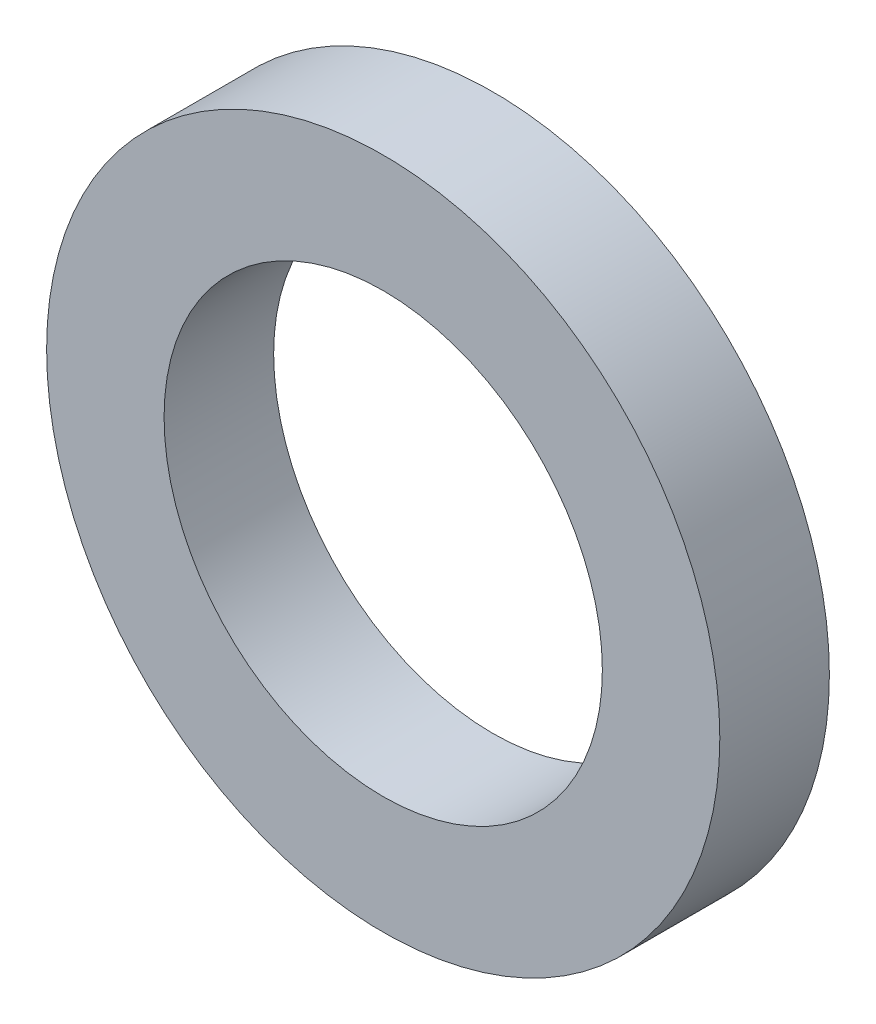
from build123d import *

# Parameters (mm, degrees)
SKETCH1_R           = 9.7536
SKETCH1_R_2         = 6.35
BOSS_EXTRUDE1_DEPTH = 3.175


with BuildPart() as part:
    # Sketch1 → Boss-Extrude1 (new body)
    with BuildSketch(Plane.XY):
        Circle(SKETCH1_R)
        Circle(SKETCH1_R_2, mode=Mode.SUBTRACT)
    extrude(amount=BOSS_EXTRUDE1_DEPTH)


solid = part.part
